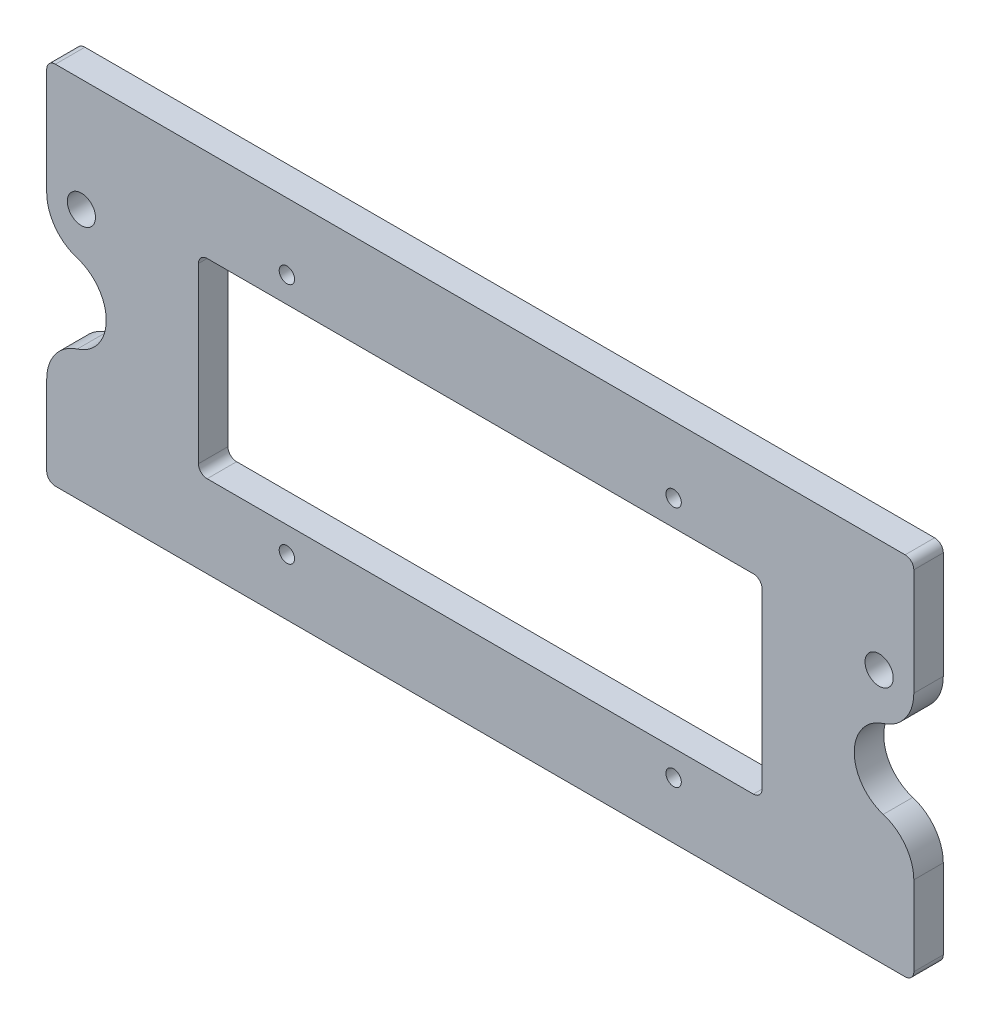
from build123d import *

# Parameters (mm, degrees)
SKETCH1_W           = 200
SKETCH1_H           = 84.3
BOSS_EXTRUDE1_DEPTH = 6.8
SKETCH2_R           = 3.25
CUT_EXTRUDE1_DEPTH  = 6.8
FILLET1_R           = 2
SKETCH3_R           = 1.775
SKETCH3_W           = 130
SKETCH3_H           = 44
CUT_EXTRUDE2_DEPTH  = 109.732987175
FILLET2_R           = 2
CUT_EXTRUDE3_DEPTH  = 10
FILLET3_R           = 10


with BuildPart() as part:
    # Sketch1 → Boss-Extrude1 (new body)
    with BuildSketch(Plane.XY):
        Rectangle(SKETCH1_W, SKETCH1_H)
    extrude(amount=BOSS_EXTRUDE1_DEPTH)

    # Sketch2 → Cut-Extrude1 (cut)
    with BuildSketch(Plane.XY.offset(6.8)):
        with Locations((-92, 16.15)):
            Circle(SKETCH2_R)
        with Locations((92, 16.15)):
            Circle(SKETCH2_R)
    extrude(amount=-CUT_EXTRUDE1_DEPTH, mode=Mode.SUBTRACT)

    # Fillet1
    fillet1_edges = [part.edges().sort_by_distance(p)[0] for p in [
        (-100, 42.15, 3.4),
        (100, 42.15, 3.4),
        (100, -42.15, 3.4),
        (-100, -42.15, 3.4),
    ]]
    fillet(fillet1_edges, radius=FILLET1_R)

    # Sketch3 → Cut-Extrude2 (cut, through all)
    with BuildSketch(Plane.XY.offset(6.8)):
        with Locations((-44.6, 26.7722)):
            Circle(SKETCH3_R)
        with Locations((44.6, 26.7722)):
            Circle(SKETCH3_R)
        with Locations((44.6, -29.0722)):
            Circle(SKETCH3_R)
        with Locations((-44.6, -29.0722)):
            Circle(SKETCH3_R)
        with Locations((0, -1.15)):
            Rectangle(SKETCH3_W, SKETCH3_H)
    extrude(amount=-CUT_EXTRUDE2_DEPTH, mode=Mode.SUBTRACT)

    # Fillet2
    fillet2_edges = [part.edges().sort_by_distance(p)[0] for p in [
        (-65, -23.15, 3.4),
        (-65, 20.85, 3.4),
        (65, 20.85, 3.4),
        (65, -23.15, 3.4),
    ]]
    fillet(fillet2_edges, radius=FILLET2_R)

    # Sketch4 → Cut-Extrude3 (cut)
    with BuildSketch(Plane.XY.offset(6.8)):
        with BuildLine():
            Line((-95.764164993, 6.349975114), (-108.891829776, 6.349975114))
            Line((-108.891829776, 6.349975114), (-108.891829776, -12.650024886))
            Line((-108.891829776, -12.650024886), (-95.764164993, -12.650024886))
            ThreePointArc((-95.764164993, -12.650024886), (-86.264164993, -3.150024886), (-95.764164993, 6.349975114))
        make_face()
    cut_extrude3 = extrude(amount=-CUT_EXTRUDE3_DEPTH, mode=Mode.SUBTRACT)

    # Mirror3: Cut-Extrude3 across plane
    add(cut_extrude3.mirror(Plane(origin=(0, 0, 0), x_dir=(0, 0, 1), z_dir=(1, 0, 0))), mode=Mode.SUBTRACT)

    # Fillet3
    fillet3_edges = [part.edges().sort_by_distance(p)[0] for p in [
        (-100, -12.650024886, 3.4),
        (-100, 6.349975114, 3.4),
        (100, 6.349975114, 3.4),
        (100, -12.650024886, 3.4),
    ]]
    fillet(fillet3_edges, radius=FILLET3_R)


solid = part.part
